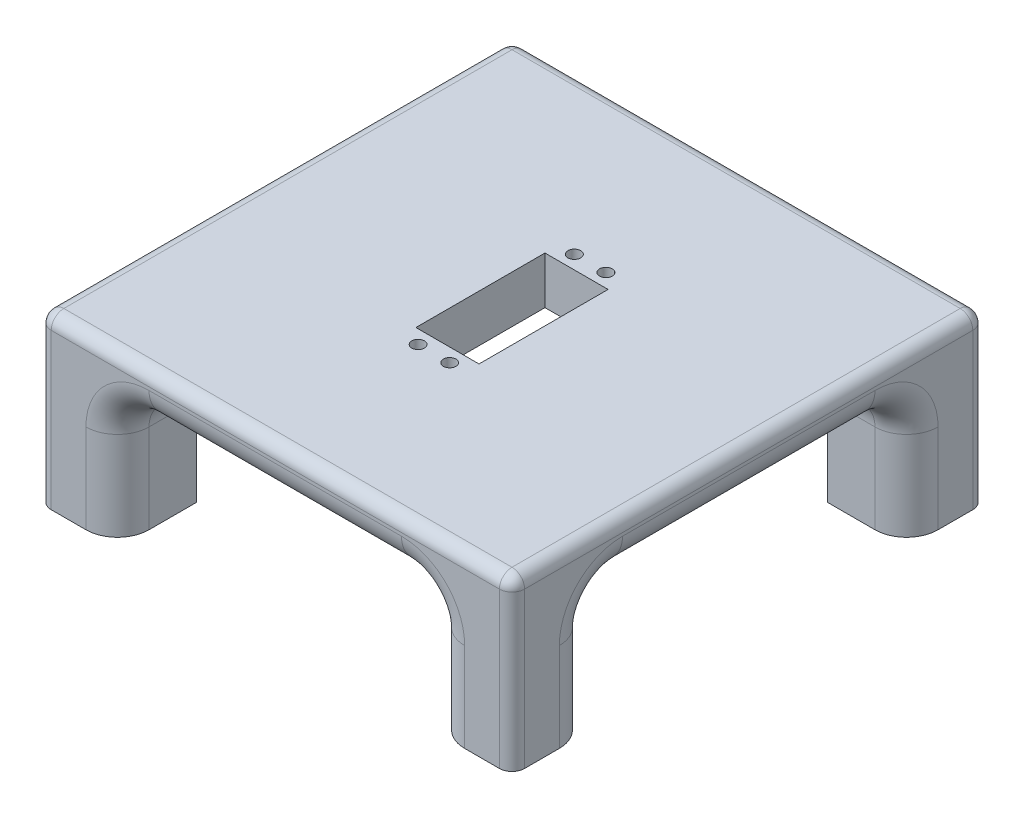
from build123d import *

# Parameters (mm, degrees)
SKETCH1_W           = 150
SKETCH1_H           = 150
BOSS_EXTRUDE1_DEPTH = 15
SKETCH2_W           = 20.0000108
SKETCH2_H           = 40.894
CUT_EXTRUDE1_DEPTH  = 15
SKETCH4_W           = 25
SKETCH4_H           = 25
BOSS_EXTRUDE2_DEPTH = 38.222
FILLET1_R           = 10
FILLET2_R           = 4
SKETCH5_R           = 2
SKETCH5_R_2         = 2.01
CUT_EXTRUDE2_DEPTH  = 53.222


with BuildPart() as part:
    # Sketch1 → Boss-Extrude1 (new body)
    with BuildSketch(Plane(origin=(0, 0, 0), x_dir=(1, 0, 0), z_dir=(0, 1, 0))):
        with Locations((-75, 75)):
            Rectangle(SKETCH1_W, SKETCH1_H)
    extrude(amount=BOSS_EXTRUDE1_DEPTH)

    # Sketch2 → Cut-Extrude1 (cut)
    with BuildSketch(Plane(origin=(0, 15, 0), x_dir=(1, 0, 0), z_dir=(0, 1, 0))):
        with Locations((-75, 75)):
            Rectangle(SKETCH2_W, SKETCH2_H)
    extrude(amount=-CUT_EXTRUDE1_DEPTH, mode=Mode.SUBTRACT)

    # Sketch4 → Boss-Extrude2 (add)
    with BuildSketch(Plane.XZ):
        with Locations((-137.5, -12.5)):
            Rectangle(SKETCH4_W, SKETCH4_H)
        with Locations((-137.5, -137.5)):
            Rectangle(SKETCH4_W, SKETCH4_H)
        with Locations((-12.5, -12.5)):
            Rectangle(SKETCH4_W, SKETCH4_H)
        with Locations((-12.5, -137.5)):
            Rectangle(SKETCH4_W, SKETCH4_H)
    extrude(amount=BOSS_EXTRUDE2_DEPTH)

    # Fillet1
    fillet1_edges = [part.edges().sort_by_distance(p)[0] for p in [
        (-75, 0, 0),
        (-137.5, 0, -25),
        (-150, -19.111, -25),
        (-125, 0, -12.5),
        (-125, -19.111, 0),
        (-150, 0, -75),
        (-125, 0, -137.5),
        (-125, -19.111, -150),
        (-137.5, 0, -125),
        (-150, -19.111, -125),
        (0, 0, -75),
        (-25, 0, -12.5),
        (-25, -19.111, 0),
        (-12.5, 0, -25),
        (0, -19.111, -25),
        (-75, 0, -150),
        (-12.5, 0, -125),
        (0, -19.111, -125),
        (-25, 0, -137.5),
        (-25, -19.111, -150),
    ]]
    fillet(fillet1_edges, radius=FILLET1_R)

    # Fillet2
    fillet2_edges = [part.edges().sort_by_distance(p)[0] for p in [
        (-150, 15, -75),
        (-75, 15, 0),
        (0, 15, -75),
        (0, -11.611, 0),
        (-150, -11.611, 0),
        (-150, -11.611, -150),
        (0, -11.611, -150),
        (-75, 15, -150),
    ]]
    fillet(fillet2_edges, radius=FILLET2_R)

    # Sketch5 → Cut-Extrude2 (cut)
    with BuildSketch(Plane(origin=(0, 15, 0), x_dir=(1, 0, 0), z_dir=(0, 1, 0))):
        with Locations(Location((-80, 50.25, 0), (0, 0, 270))):
            Circle(SKETCH5_R)
        with Locations(Location((-70, 50.25, 0), (0, 0, 270))):
            Circle(SKETCH5_R)
        with Locations(Location((-80, 99.75, 0), (0, 0, 270))):
            Circle(SKETCH5_R_2)
        with Locations(Location((-70, 99.75, 0), (0, 0, 270))):
            Circle(SKETCH5_R_2)
    extrude(amount=-CUT_EXTRUDE2_DEPTH, mode=Mode.SUBTRACT)


solid = part.part
